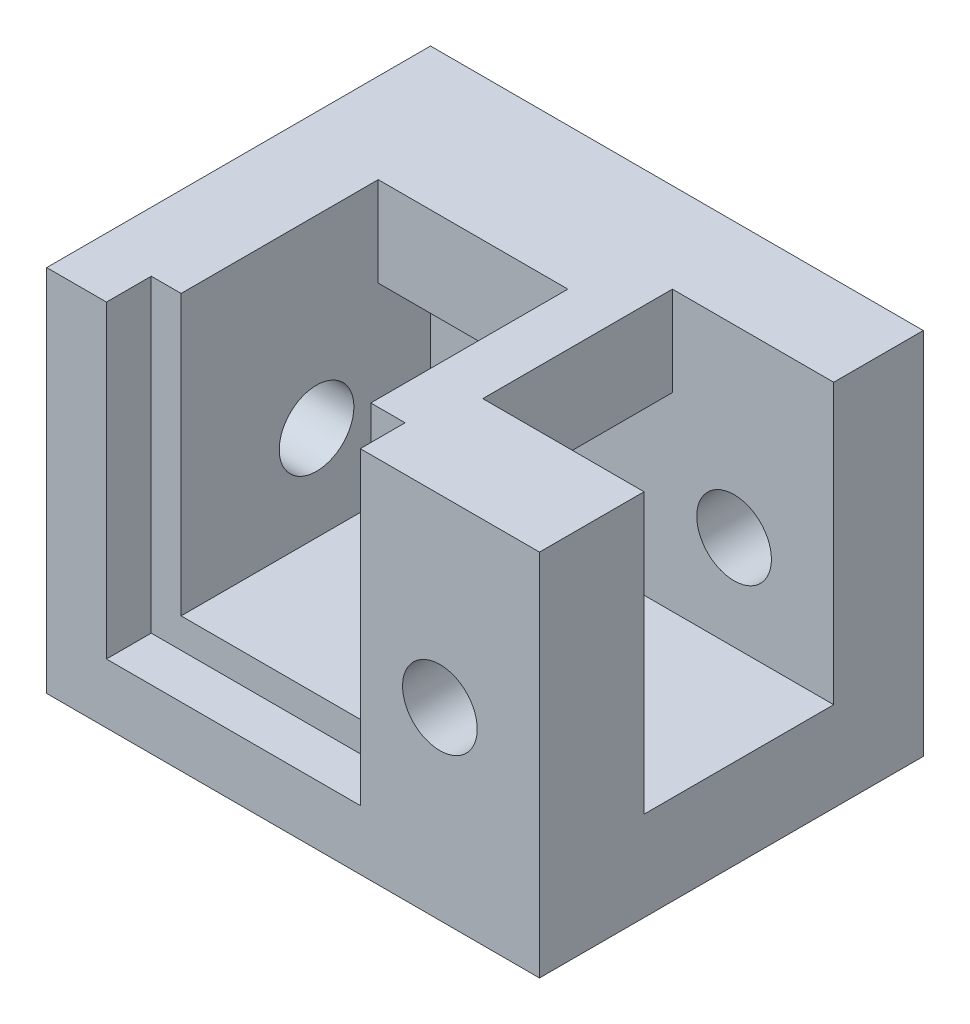
from build123d import *

# Parameters (mm, degrees)
SKETCH_3_W          = 33
SKETCH_3_H          = 22.7
EXTRUDE_2_DEPTH     = 6
SKETCH_4_W          = 14.3
SKETCH_4_H          = 4
EXTRUDE_3_DEPTH     = 12.7
SKETCH_5_R          = 2.5
CUT_EXTRUDE_2_DEPTH = 45.203845987
SKETCH_6_R          = 2.5
CUT_EXTRUDE_3_DEPTH = 40.924679084
SKETCH_7_W          = 12.7
SKETCH_7_H          = 3.5
EXTRUDE_4_DEPTH     = 6
EXTRUDE_START       = 3
SKETCH_8_W          = 12
SKETCH_8_H          = 24.7
SKETCH_8_R          = 2.5
EXTRUDE_5_DEPTH     = 3
EXTRUDE_6_DEPTH     = 3


with BuildPart() as part:
    # 草图3 → 凸台-拉伸2 (new body)
    with BuildSketch(Plane(origin=(0, 0, 0), x_dir=(1, 0, 0), z_dir=(0, 1, 0))):
        with Locations((16.5, 11.35)):
            Rectangle(SKETCH_3_W, SKETCH_3_H)
    extrude(amount=EXTRUDE_2_DEPTH)

    # 草图4 → 凸台-拉伸3 (add)
    with BuildSketch(Plane(origin=(0, 6, 0), x_dir=(1, 0, 0), z_dir=(0, 1, 0))):
        with Locations((25.85, 2)):
            Rectangle(SKETCH_4_W, SKETCH_4_H)
        Polygon((0, 0), (6, 0), (6, 16.7), (33, 16.7), (33, 22.7), (0, 22.7), align=None)
    extrude(amount=EXTRUDE_3_DEPTH)

    # 草图5 → 切除-拉伸2 (cut, through all)
    with BuildSketch(Plane.XY):
        with Locations((26.33, 12.35)):
            Circle(SKETCH_5_R)
    extrude(amount=-CUT_EXTRUDE_2_DEPTH, mode=Mode.SUBTRACT)

    # 草图6 → 切除-拉伸3 (cut, through all)
    with BuildSketch(Plane(origin=(6, 0, 0), x_dir=(0, 0, -1), z_dir=(1, 0, 0))):
        with Locations((9.07, 12.35)):
            Circle(SKETCH_6_R)
    extrude(amount=-CUT_EXTRUDE_3_DEPTH, mode=Mode.SUBTRACT)

    # 草图7 → 凸台-拉伸4 (add)
    with BuildSketch(Plane(origin=(0, 18.7, 0), x_dir=(1, 0, 0), z_dir=(0, 1, 0))):
        Polygon((0, 22.7), (0, 0), (6, 0), (6, 13.2), (6, 16.7), (18.7, 16.7), (18.7, 22.7), align=None)
        Polygon((33, 22.7), (18.7, 22.7), (18.7, 16.7), (22.2, 16.7), (33, 16.7), align=None)
        Polygon((22.2, 16.7), (18.7, 16.7), (18.7, 13.2), (18.7, 4), (18.7, 0), (33, 0), (33, 4), (22.2, 4), align=None)
        with Locations((12.35, 14.95)):
            Rectangle(SKETCH_7_W, SKETCH_7_H)
    extrude(amount=EXTRUDE_4_DEPTH)

    # 草图8 → 凸台-拉伸5 (add)
    with BuildSketch(Plane.XY.offset(EXTRUDE_START)):
        with Locations((27, 12.35)):
            Rectangle(SKETCH_8_W, SKETCH_8_H)
        with Locations((26.33, 12.35)):
            Circle(SKETCH_8_R, mode=Mode.SUBTRACT)
    extrude(amount=-EXTRUDE_5_DEPTH)

    # 草图9 → 凸台-拉伸6 (add)
    with BuildSketch(Plane.XY):
        Polygon((0, 24.7), (0, 0), (21, 0), (21, 4), (4, 4), (4, 24.7), align=None)
    extrude(amount=EXTRUDE_6_DEPTH)


solid = part.part
